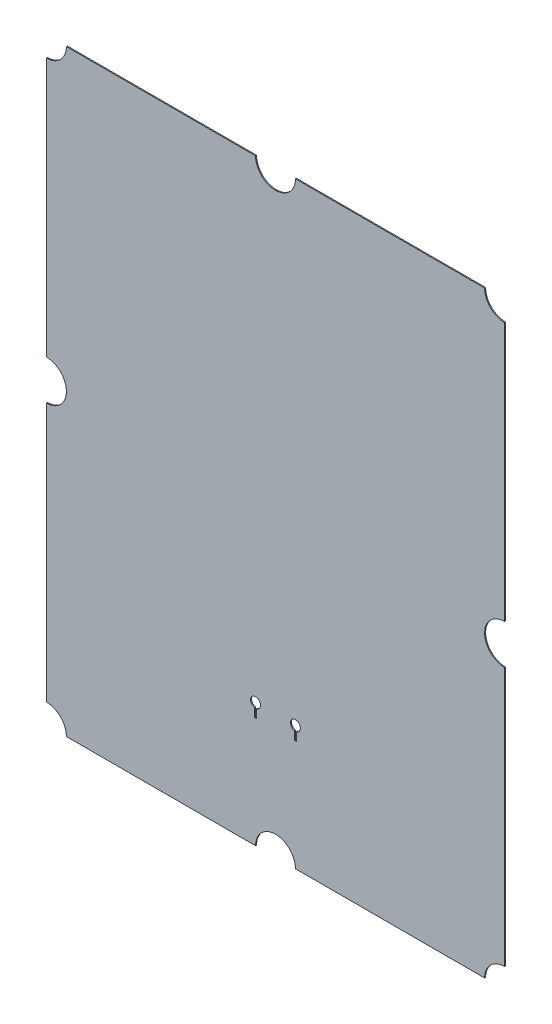
from build123d import *

# Parameters (mm, degrees)
BOSS_EXTRUDE1_DEPTH = 0.5


with BuildPart() as part:
    # Sketch1 → Boss-Extrude1 (new body)
    with BuildSketch(Plane(origin=(0, 0, 0), x_dir=(-1, 0, 0), z_dir=(0, 0, -1))):
        with BuildLine():
            Line((105, 150), (10, 150))
            ThreePointArc((10, 150), (0, 140), (-10, 150))
            Line((-10, 150), (-105, 150))
            ThreePointArc((-105, 150), (-107.928932188, 142.928932188), (-115, 140))
            Line((-115, 140), (-115, 10))
            ThreePointArc((-115, 10), (-105, 0), (-115, -10))
            Line((-115, -10), (-115, -140))
            ThreePointArc((-115, -140), (-107.928932188, -142.928932188), (-105, -150))
            Line((-105, -150), (-10, -150))
            ThreePointArc((-10, -150), (0, -140), (10, -150))
            Line((10, -150), (105, -150))
            ThreePointArc((105, -150), (107.928932188, -142.928932188), (115, -140))
            Line((115, -140), (115, -10))
            ThreePointArc((115, -10), (105, 0), (115, 10))
            Line((115, 10), (115, 140))
            ThreePointArc((115, 140), (107.928932188, 142.928932188), (105, 150))
        make_face()
        with BuildLine():
            Line((9.5, -94.448385239), (9.5, -90.141798169))
            ThreePointArc((9.5, -90.141798169), (10, -85.192308426), (10.5, -90.141798169))
            Line((10.5, -90.141798169), (10.5, -94.448385239))
            Line((10.5, -94.448385239), (9.5, -94.448385239))
        make_face(mode=Mode.SUBTRACT)
        with BuildLine():
            Line((-10.5, -94.448385239), (-10.5, -90.141798169))
            ThreePointArc((-10.5, -90.141798169), (-10, -85.192308426), (-9.5, -90.141798169))
            Line((-9.5, -90.141798169), (-9.5, -94.448385239))
            Line((-9.5, -94.448385239), (-10.5, -94.448385239))
        make_face(mode=Mode.SUBTRACT)
    extrude(amount=-BOSS_EXTRUDE1_DEPTH)


solid = part.part
